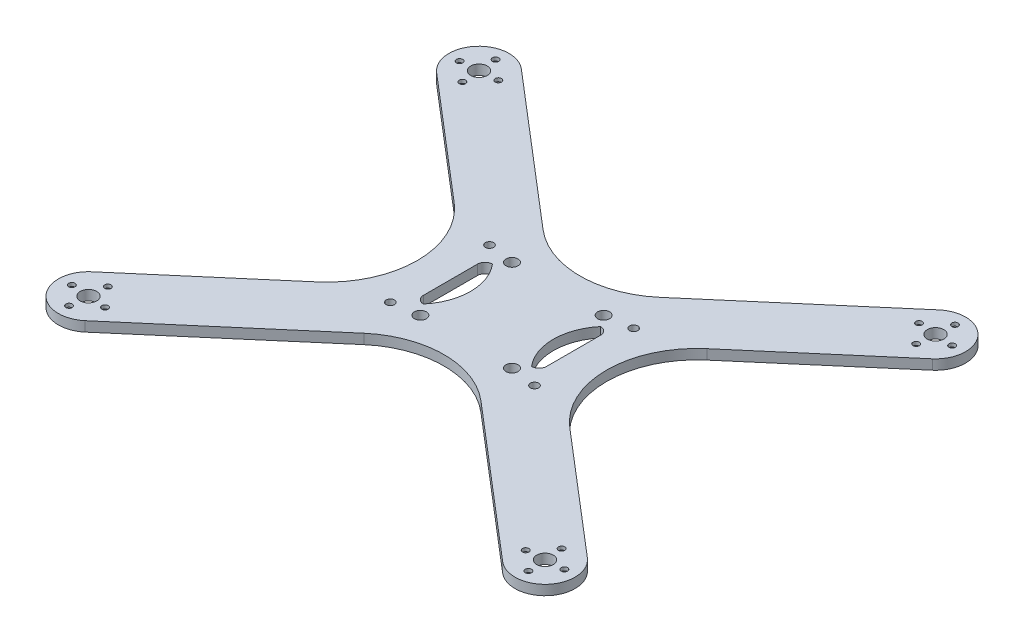
from build123d import *

# Parameters (mm, degrees)
BOSS_EXTRUDE1_DEPTH = 3.3
SKETCH2_R           = 1.05
SKETCH2_R_2         = 2.75
SKETCH2_R_3         = 1.375
CUT_EXTRUDE1_DEPTH  = 3.3
SKETCH3_R           = 1.9
CUT_EXTRUDE2_DEPTH  = 2.15
SKETCH6_R           = 2
CUT_EXTRUDE3_DEPTH  = 10


with BuildPart() as part:
    # Sketch1 → Boss-Extrude1 (new body)
    with BuildSketch(Plane(origin=(0, 0, 0), x_dir=(1, 0, 0), z_dir=(0, 1, 0))):
        with BuildLine():
            Line((-82.493420768, 57.400657923), (-42.038461538, 22.79802623))
            ThreePointArc((-42.038461538, 22.79802623), (-31.538461538, 0), (-42.038461538, -22.79802623))
            Line((-42.038461538, -22.79802623), (-82.493420768, -57.400657923))
            ThreePointArc((-82.493420768, -57.400657923), (-83.592762845, -71.5), (-69.493420768, -72.599342077))
            Line((-69.493420768, -72.599342077), (-19.5, -29.838109366))
            ThreePointArc((-19.5, -29.838109366), (0, -22.636135597), (19.5, -29.838109366))
            Line((19.5, -29.838109366), (69.493420768, -72.599342077))
            ThreePointArc((69.493420768, -72.599342077), (83.592762845, -71.5), (82.493420768, -57.400657923))
            Line((82.493420768, -57.400657923), (42.038461538, -22.79802623))
            ThreePointArc((42.038461538, -22.79802623), (31.538461538, 0), (42.038461538, 22.79802623))
            Line((42.038461538, 22.79802623), (82.493420768, 57.400657923))
            ThreePointArc((82.493420768, 57.400657923), (83.592762845, 71.5), (69.493420768, 72.599342077))
            Line((69.493420768, 72.599342077), (19.5, 29.838109366))
            ThreePointArc((19.5, 29.838109366), (0, 22.636135597), (-19.5, 29.838109366))
            Line((-19.5, 29.838109366), (-69.493420768, 72.599342077))
            ThreePointArc((-69.493420768, 72.599342077), (-83.592762845, 71.5), (-82.493420768, 57.400657923))
        make_face()
    extrude(amount=BOSS_EXTRUDE1_DEPTH)

    # Sketch2 → Cut-Extrude1 (cut)
    with BuildSketch(Plane(origin=(0, 3.3, 0), x_dir=(1, 0, 0), z_dir=(0, 1, 0))):
        with Locations(Location((-76.45983211, 70.981844236, 0), (0, 0, 270))):
            Circle(SKETCH2_R)
        with Locations(Location((-70.011576532, 65.466411342, 0), (0, 0, 270))):
            Circle(SKETCH2_R)
        with Locations(Location((-75.527009425, 59.018155764, 0), (0, 0, 270))):
            Circle(SKETCH2_R)
        with Locations(Location((-81.975265004, 64.533588658, 0), (0, 0, 270))):
            Circle(SKETCH2_R)
        with Locations(Location((75.527009425, 59.018155764, 0), (0, 0, 270))):
            Circle(SKETCH2_R)
        with Locations(Location((81.975265004, 64.533588658, 0), (0, 0, 270))):
            Circle(SKETCH2_R)
        with Locations(Location((76.45983211, 70.981844236, 0), (0, 0, 270))):
            Circle(SKETCH2_R)
        with Locations(Location((70.011576532, 65.466411342, 0), (0, 0, 270))):
            Circle(SKETCH2_R)
        with Locations(Location((-76.45983211, -70.981844236, 0), (0, 0, 270))):
            Circle(SKETCH2_R)
        with Locations(Location((-81.975265004, -64.533588658, 0), (0, 0, 270))):
            Circle(SKETCH2_R)
        with Locations(Location((-75.527009425, -59.018155764, 0), (0, 0, 270))):
            Circle(SKETCH2_R)
        with Locations(Location((-70.011576532, -65.466411342, 0), (0, 0, 270))):
            Circle(SKETCH2_R)
        with Locations(Location((70.011576532, -65.466411342, 0), (0, 0, 270))):
            Circle(SKETCH2_R)
        with Locations(Location((76.45983211, -70.981844236, 0), (0, 0, 270))):
            Circle(SKETCH2_R)
        with Locations(Location((81.975265004, -64.533588658, 0), (0, 0, 270))):
            Circle(SKETCH2_R)
        with Locations(Location((75.527009425, -59.018155764, 0), (0, 0, 270))):
            Circle(SKETCH2_R)
        with Locations(Location((-75.993420768, 65, 0), (0, 0, 270))):
            Circle(SKETCH2_R_2)
        with Locations(Location((75.993420768, 65, 0), (0, 0, 270))):
            Circle(SKETCH2_R_2)
        with Locations(Location((75.993420768, -65, 0), (0, 0, 270))):
            Circle(SKETCH2_R_2)
        with Locations(Location((-75.993420768, -65, 0), (0, 0, 270))):
            Circle(SKETCH2_R_2)
        with Locations(Location((-24, 16.5, 0), (0, 0, 270))):
            Circle(SKETCH2_R_3)
        with Locations(Location((24, 16.5, 0), (0, 0, 270))):
            Circle(SKETCH2_R_3)
        with Locations(Location((24, -16.5, 0), (0, 0, 270))):
            Circle(SKETCH2_R_3)
        with Locations(Location((-24, -16.5, 0), (0, 0, 270))):
            Circle(SKETCH2_R_3)
    extrude(amount=-CUT_EXTRUDE1_DEPTH, mode=Mode.SUBTRACT)

    # Sketch3 → Cut-Extrude2 (cut)
    with BuildSketch(Plane.XZ):
        with Locations(Location((-76.45983211, 70.981844236, 0), (0, 0, 270))):
            Circle(SKETCH3_R)
        with Locations(Location((-70.011576532, 65.466411342, 0), (0, 0, 270))):
            Circle(SKETCH3_R)
        with Locations(Location((-75.527009425, 59.018155764, 0), (0, 0, 270))):
            Circle(SKETCH3_R)
        with Locations(Location((-81.975265004, 64.533588658, 0), (0, 0, 270))):
            Circle(SKETCH3_R)
        with Locations(Location((81.975265004, 64.533588658, 0), (0, 0, 270))):
            Circle(SKETCH3_R)
        with Locations(Location((75.527009425, 59.018155764, 0), (0, 0, 270))):
            Circle(SKETCH3_R)
        with Locations(Location((70.011576532, 65.466411342, 0), (0, 0, 270))):
            Circle(SKETCH3_R)
        with Locations(Location((76.45983211, 70.981844236, 0), (0, 0, 270))):
            Circle(SKETCH3_R)
        with Locations(Location((76.45983211, -70.981844236, 0), (0, 0, 270))):
            Circle(SKETCH3_R)
        with Locations(Location((70.011576532, -65.466411342, 0), (0, 0, 270))):
            Circle(SKETCH3_R)
        with Locations(Location((75.527009425, -59.018155764, 0), (0, 0, 270))):
            Circle(SKETCH3_R)
        with Locations(Location((81.975265004, -64.533588658, 0), (0, 0, 270))):
            Circle(SKETCH3_R)
        with Locations(Location((-81.975265004, -64.533588658, 0), (0, 0, 270))):
            Circle(SKETCH3_R)
        with Locations(Location((-75.527009425, -59.018155764, 0), (0, 0, 270))):
            Circle(SKETCH3_R)
        with Locations(Location((-70.011576532, -65.466411342, 0), (0, 0, 270))):
            Circle(SKETCH3_R)
        with Locations(Location((-76.45983211, -70.981844236, 0), (0, 0, 270))):
            Circle(SKETCH3_R)
    extrude(amount=-CUT_EXTRUDE2_DEPTH, mode=Mode.SUBTRACT)

    # Sketch6 → Cut-Extrude3 (cut)
    with BuildSketch(Plane(origin=(0, 3.3, 0), x_dir=(1, 0, 0), z_dir=(0, 1, 0))):
        with Locations(Location((-15.25, 15.25, 0), (0, 0, 270))):
            Circle(SKETCH6_R)
        with Locations(Location((15.25, 15.25, 0), (0, 0, 270))):
            Circle(SKETCH6_R)
        with Locations(Location((15.25, -15.25, 0), (0, 0, 270))):
            Circle(SKETCH6_R)
        with Locations(Location((-15.25, -15.25, 0), (0, 0, 270))):
            Circle(SKETCH6_R)
        with BuildLine():
            Line((-20.5, 9), (-20.5, -9))
            ThreePointArc((-20.5, -9), (-19.767766953, -10.767766953), (-18, -11.5))
            ThreePointArc((-18, -11.5), (-13.775017592, 0), (-18, 11.5))
            ThreePointArc((-18, 11.5), (-19.767766953, 10.767766953), (-20.5, 9))
        make_face()
        with BuildLine():
            Line((20.5, 9), (20.5, -9))
            ThreePointArc((20.5, -9), (19.767766953, -10.767766953), (18, -11.5))
            ThreePointArc((18, -11.5), (13.775017592, 0), (18, 11.5))
            ThreePointArc((18, 11.5), (19.767766953, 10.767766953), (20.5, 9))
        make_face()
    extrude(amount=-CUT_EXTRUDE3_DEPTH, mode=Mode.SUBTRACT)


solid = part.part
